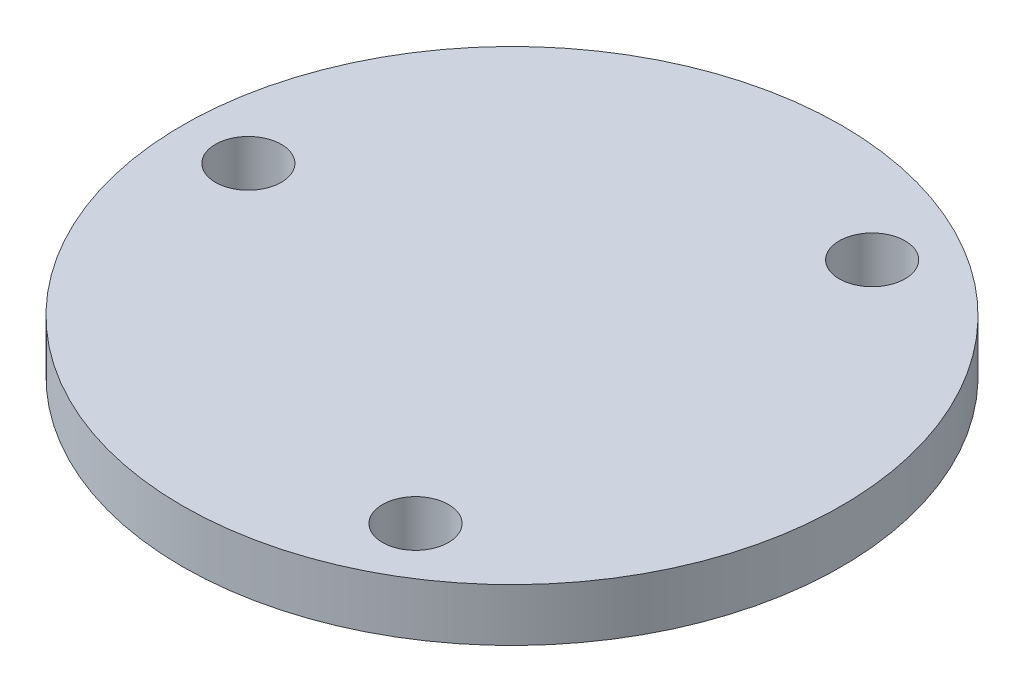
from build123d import *

# Parameters (mm, degrees)
SKETCH_1_R      = 10
SKETCH_1_R_2    = 1
EXTRUDE_1_DEPTH = 1.6


with BuildPart() as part:
    # 草图1 → 凸台-拉伸1 (new body)
    with BuildSketch(Plane(origin=(0, 0, 0), x_dir=(1, 0, 0), z_dir=(0, 1, 0))):
        Circle(SKETCH_1_R)
        with Locations((-8, 0)):
            Circle(SKETCH_1_R_2, mode=Mode.SUBTRACT)
        with Locations((4, 6.92820323)):
            Circle(SKETCH_1_R_2, mode=Mode.SUBTRACT)
        with Locations((4, -6.92820323)):
            Circle(SKETCH_1_R_2, mode=Mode.SUBTRACT)
    extrude(amount=EXTRUDE_1_DEPTH)


solid = part.part
